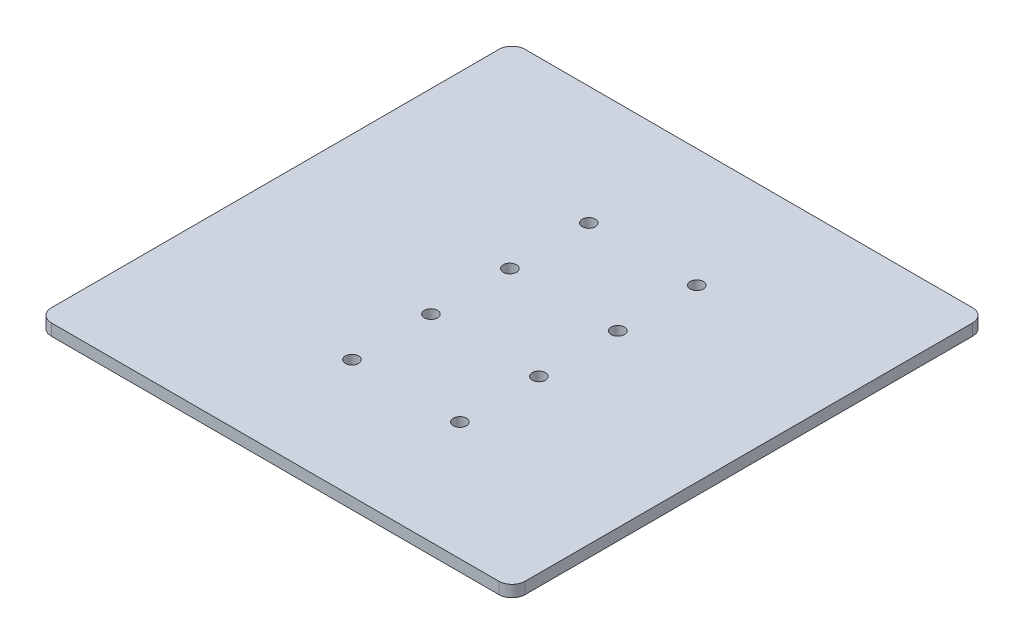
from build123d import *

# Parameters (mm, degrees)
SKETCH1_W                   = 228.6
SKETCH1_H                   = 228.6
BOSS_EXTRUDE1_DEPTH         = 5.588
F_1_4_0_25_DIAMETER_HOLE1_D = 6.35
LPATTERN1_COUNT             = 4
LPATTERN1_PITCH             = 38.1
FILLET1_R                   = 6.35


with BuildPart() as part:
    # Sketch1 → Boss-Extrude1 (new body)
    with BuildSketch(Plane(origin=(0, 0, 0), x_dir=(1, 0, 0), z_dir=(0, 1, 0))):
        Rectangle(SKETCH1_W, SKETCH1_H)
    extrude(amount=BOSS_EXTRUDE1_DEPTH)

    # 1/4 (0.25) Diameter Hole1 (through all)
    with Locations(Plane(origin=(0, 5.588, 0), x_dir=(1, 0, 0), z_dir=(0, 1, 0))):
        with Locations((-20.066, 57.15), (32.004, 57.15)):
            f_1_4_0_25_diameter_hole1 = Hole(F_1_4_0_25_DIAMETER_HOLE1_D / 2)

    # LPattern1: 1/4 (0.25) Diameter Hole1 ×4
    with Locations(*[(0, 0, i * LPATTERN1_PITCH) for i in range(1, LPATTERN1_COUNT)]):
        add(f_1_4_0_25_diameter_hole1, mode=Mode.SUBTRACT)

    # Fillet1
    fillet1_edges = [part.edges().sort_by_distance(p)[0] for p in [
        (-114.3, 2.794, -114.3),
        (114.3, 2.794, -114.3),
        (114.3, 2.794, 114.3),
        (-114.3, 2.794, 114.3),
    ]]
    fillet(fillet1_edges, radius=FILLET1_R)


solid = part.part
